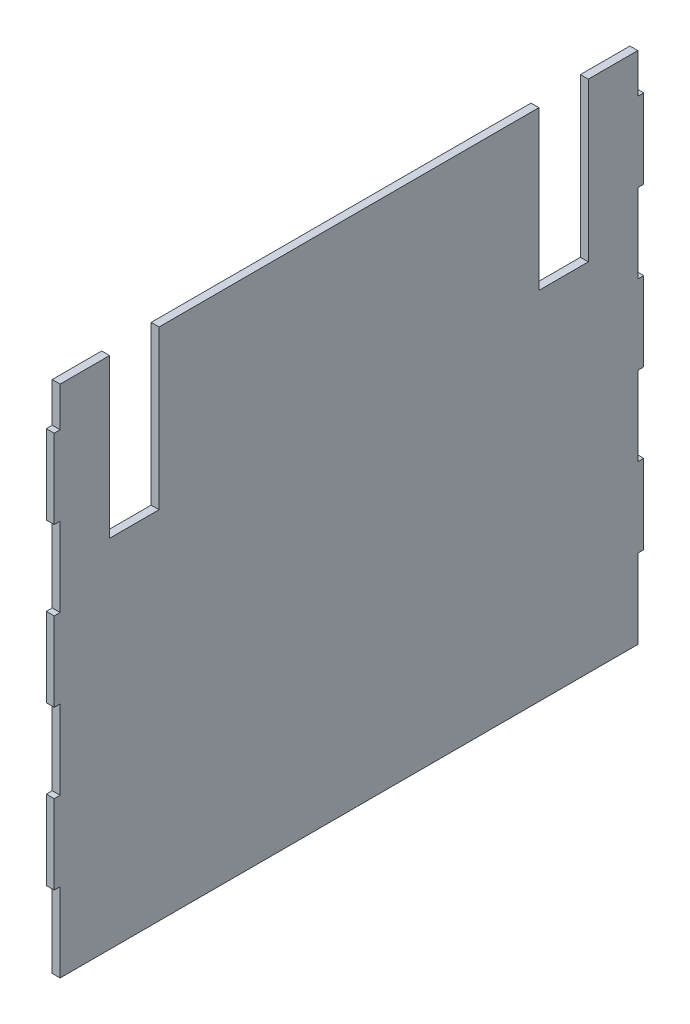
from build123d import *

# Parameters (mm, degrees)
BOSS_EXTRUDE1_DEPTH = 4


with BuildPart() as part:
    # Sketch1 → Boss-Extrude1 (new body)
    with BuildSketch(Plane(origin=(0, 0, 0), x_dir=(0, 0, -1), z_dir=(1, 0, 0))):
        Polygon((-282.987112399, 143.223220035), (-257.987112399, 143.223220035), (-257.987112399, 63.223220035), (-232.987112399, 63.223220035), (-232.987112399, 143.223220035), (-40.987112399, 143.223220035), (-40.987112399, 63.223220035), (-15.987112399, 63.223220035), (-15.987112399, 143.223220035), (9.012887601, 143.223220035), (9.012887601, 123.223220035), (12.012887601, 123.223220035), (12.012887601, 83.223220035), (9.012887601, 83.223220035), (9.012887601, 43.223220035), (12.012887601, 43.223220035), (12.012887601, 3.223220035), (9.012887601, 3.223220035), (9.012887601, -36.776779965), (12.012887601, -36.776779965), (12.012887601, -76.776779965), (9.012887601, -76.776779965), (9.012887601, -116.776779965), (-282.987112399, -116.776779965), (-282.987112399, -76.776779965), (-285.987112399, -76.776779965), (-285.987112399, -36.776779965), (-282.987112399, -36.776779965), (-282.987112399, 3.223220035), (-285.987112399, 3.223220035), (-285.987112399, 43.223220035), (-282.987112399, 43.223220035), (-282.987112399, 83.223220035), (-285.987112399, 83.223220035), (-285.987112399, 123.223220035), (-282.987112399, 123.223220035), align=None)
    extrude(amount=BOSS_EXTRUDE1_DEPTH)


solid = part.part
